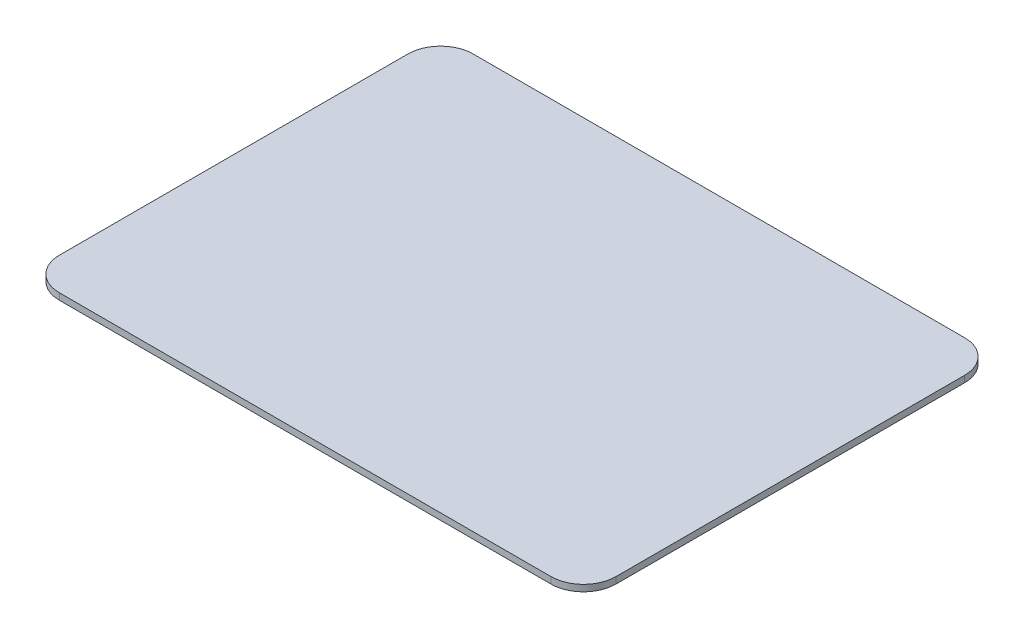
from build123d import *

# Parameters (mm, degrees)
SKETCH_1_W      = 256.36587371
SKETCH_1_H      = 190.532136394
EXTRUDE_1_DEPTH = 3
FILLET_1_R      = 15


with BuildPart() as part:
    # 草图1 → 凸台-拉伸1 (new body)
    with BuildSketch(Plane(origin=(0, 0, 0), x_dir=(1, 0, 0), z_dir=(0, 1, 0))):
        with Locations((149.118834174, 46.010069649)):
            Rectangle(SKETCH_1_W, SKETCH_1_H)
    extrude(amount=EXTRUDE_1_DEPTH)

    # 圆角1
    fillet_1_edges = [part.edges().sort_by_distance(p)[0] for p in [
        (20.935897319, 1.5, -141.276137846),
        (277.301771029, 1.5, -141.276137846),
        (277.301771029, 1.5, 49.255998548),
        (20.935897319, 1.5, 49.255998548),
    ]]
    fillet(fillet_1_edges, radius=FILLET_1_R)


solid = part.part
